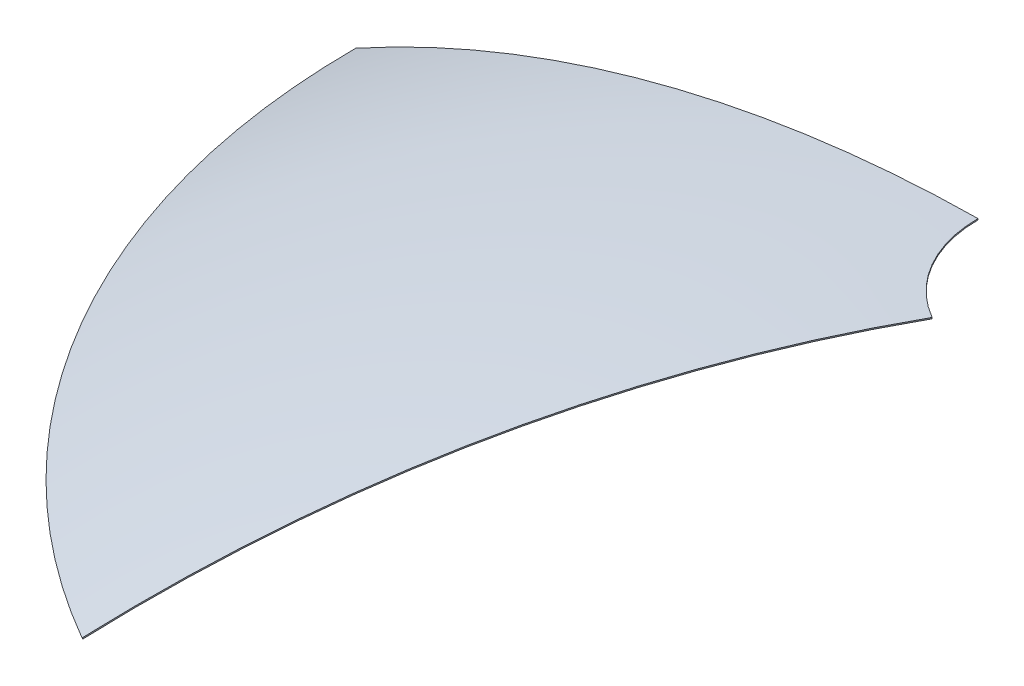
from build123d import *

# Parameters (mm, degrees)
REVOLVE1_ANGLE     = 60
SKETCH4_R          = 50.25
CUT_EXTRUDE3_DEPTH = 10


with BuildPart() as part:
    # Sketch1 → Revolve1 (revolve)
    with BuildSketch(Plane.XY):
        with BuildLine():
            Line((-45, 1.936673673), (-10, 1.936673673))
            Line((-10, 1.936673673), (-10, 2.436673673))
            Line((-10, 2.436673673), (-45.000375853, 2.436673673))
            ThreePointArc((-45.000375853, 2.436673673), (-45.557674224, 2.435543108), (-46.114971099, 2.433826721))
            ThreePointArc((-46.114971099, 2.433826721), (-177.046295247, -14.475660779), (-299.740246695, -63.211034879))
            Line((-299.740246695, -63.211034879), (-299.499248826, -63.64912166))
            ThreePointArc((-299.499248826, -63.64912166), (-176.921010606, -14.959710114), (-46.11316839, 1.933829971))
            ThreePointArc((-46.11316839, 1.933829971), (-45.556584942, 1.935544259), (-45, 1.936673673))
        make_face()
    revolve(axis=Axis((0, -998.5, 0), (0, 1, 0)), revolution_arc=REVOLVE1_ANGLE)

    # Sketch4 → Cut-Extrude3 (cut)
    with BuildSketch(Plane(origin=(0, 0, 0), x_dir=(1, 0, 0), z_dir=(0, 1, 0))):
        Circle(SKETCH4_R)
    extrude(amount=CUT_EXTRUDE3_DEPTH, mode=Mode.SUBTRACT)


solid = part.part
